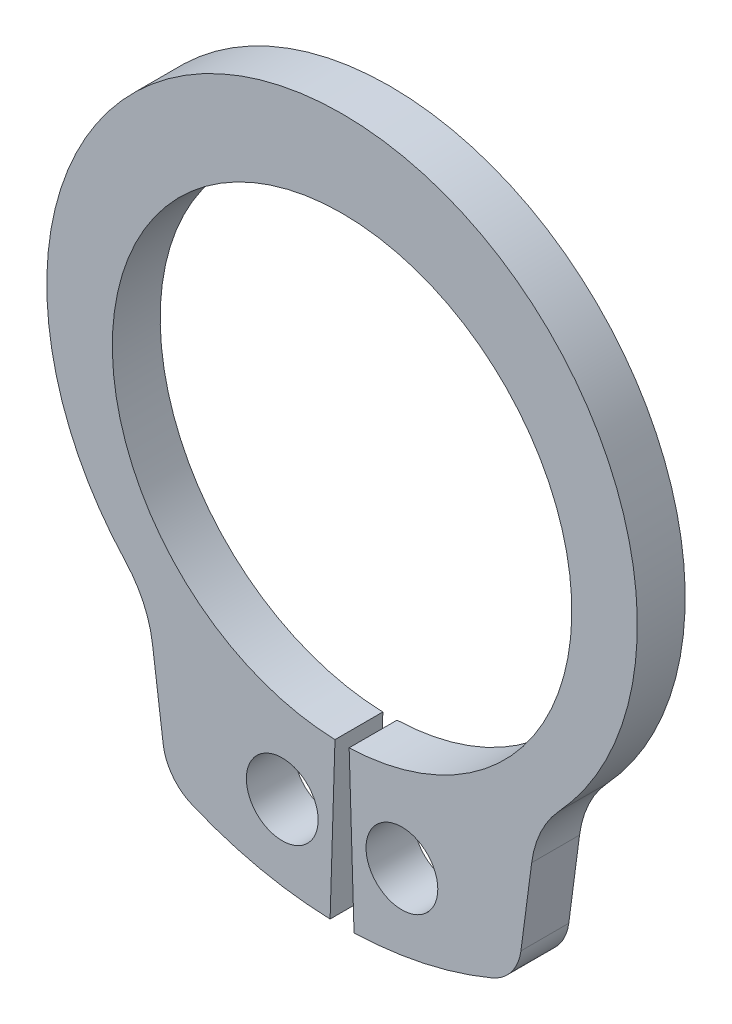
from build123d import *

# Parameters (mm, degrees)
BODYSKE_R  = 0.75
BODY_DEPTH = 1


with BuildPart() as part:
    # BodySke → Body (new body)
    with BuildSketch(Plane.XY):
        with BuildLine():
            Line((0.148148148, -4.797713218), (0.25, -8.096141056))
            ThreePointArc((0.25, -8.096141056), (1.719519522, -7.915380762), (3.131586442, -7.470151696))
            ThreePointArc((3.131586442, -7.470151696), (3.539619012, -7.15498098), (3.736415693, -6.678436938))
            Line((3.736415693, -6.678436938), (3.961309857, -4.970196166))
            ThreePointArc((3.961309857, -4.970196166), (4.15202859, -4.318338913), (4.531084927, -3.754771875))
            ThreePointArc((4.531084927, -3.754771875), (0, 6.6), (-4.531084927, -3.754771875))
            ThreePointArc((-4.531084927, -3.754771875), (-4.15202859, -4.318338913), (-3.961309857, -4.970196166))
            Line((-3.961309857, -4.970196166), (-3.736415693, -6.678436938))
            ThreePointArc((-3.736415693, -6.678436938), (-3.539619012, -7.15498098), (-3.131586442, -7.470151696))
            ThreePointArc((-3.131586442, -7.470151696), (-1.719519522, -7.915380762), (-0.25, -8.096141056))
            Line((-0.25, -8.096141056), (-0.148148148, -4.797713218))
            ThreePointArc((-0.148148148, -4.797713218), (0, 4.8), (0.148148148, -4.797713218))
        make_face()
        with Locations((1.25, -6.429618962)):
            Circle(BODYSKE_R, mode=Mode.SUBTRACT)
        with Locations((-1.25, -6.429618962)):
            Circle(BODYSKE_R, mode=Mode.SUBTRACT)
    extrude(amount=-BODY_DEPTH)


solid = part.part
